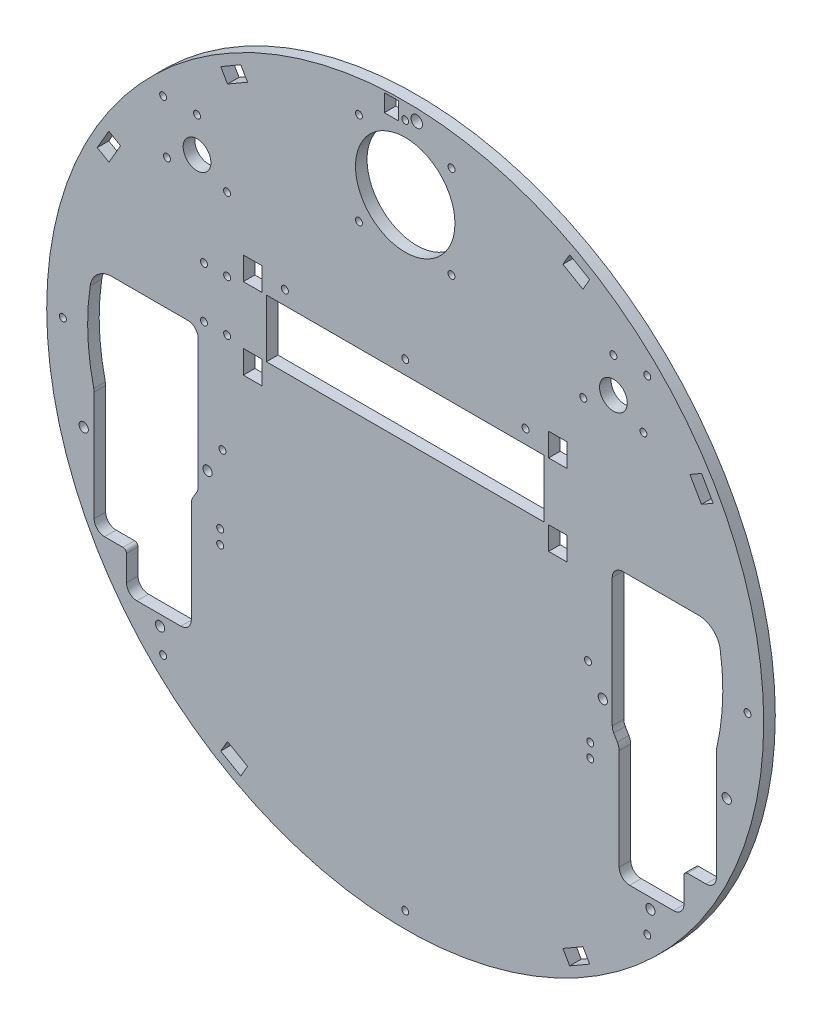
from build123d import *

# Parameters (mm, degrees)
SKETCH_1_R           = 155
EXTRUDE_1_DEPTH      = 5
SKETCH_3_R           = 6
CUT_EXTRUDE_3_DEPTH  = 10
SKETCH_7_R           = 21.5
CUT_EXTRUDE_7_DEPTH  = 10
SKETCH_8_R           = 1.5
CUT_EXTRUDE_8_DEPTH  = 7
SKETCH_12_R          = 1.5
CUT_EXTRUDE_12_DEPTH = 10
SKETCH_14_R          = 1.5
CUT_EXTRUDE_13_DEPTH = 220.260119493
SKETCH_15_R          = 1.5
SKETCH_15_W          = 120
SKETCH_15_H          = 25
CUT_EXTRUDE_14_DEPTH = 220.260119493
SKETCH_16_R          = 1.5
CUT_EXTRUDE_15_DEPTH = 220.260119493
SKETCH_17_R          = 3.25
CUT_EXTRUDE_16_DEPTH = 2
SKETCH_19_R          = 2
CUT_EXTRUDE_17_DEPTH = 220.260119493
SKETCH_20_R          = 1.5
CUT_EXTRUDE_18_DEPTH = 220.260119493
SKETCH_21_R          = 1.5
SKETCH_21_W          = 8
SKETCH_21_H          = 10
CUT_EXTRUDE_19_DEPTH = 220.260119493
SKETCH_23_R          = 2.5
SKETCH_23_W          = 6
SKETCH_23_H          = 7.5
CUT_EXTRUDE_20_DEPTH = 10


with BuildPart() as part:
    # 草图1 → 凸台-拉伸1 (new body)
    with BuildSketch(Plane.XY):
        Circle(SKETCH_1_R)
    extrude(amount=EXTRUDE_1_DEPTH)

    # 草图3 → 切除-拉伸3 (cut)
    with BuildSketch(Plane.XY.offset(5)):
        with Locations((90, 90)):
            Circle(SKETCH_3_R)
        with Locations((-90, 90)):
            Circle(SKETCH_3_R)
    extrude(amount=-CUT_EXTRUDE_3_DEPTH, mode=Mode.SUBTRACT)

    # 草图7 → 切除-拉伸7 (cut)
    with BuildSketch(Plane.XY.offset(5)):
        with Locations((0, 120)):
            Circle(SKETCH_7_R)
    extrude(amount=-CUT_EXTRUDE_7_DEPTH, mode=Mode.SUBTRACT)

    # 草图8 → 切除-拉伸8 (cut)
    with BuildSketch(Plane.XY.offset(5)):
        with Locations((-20, 140)):
            Circle(SKETCH_8_R)
        with Locations((-20, 100)):
            Circle(SKETCH_8_R)
        with Locations((20, 100)):
            Circle(SKETCH_8_R)
        with Locations((20, 140)):
            Circle(SKETCH_8_R)
    extrude(amount=-CUT_EXTRUDE_8_DEPTH, mode=Mode.SUBTRACT)

    # 草图12 → 切除-拉伸12 (cut)
    with BuildSketch(Plane.XY.offset(5)):
        with Locations((-90, 105)):
            Circle(SKETCH_12_R)
        with Locations((-77.009618943, 82.5)):
            Circle(SKETCH_12_R)
        with Locations((-102.990381057, 82.5)):
            Circle(SKETCH_12_R)
        with Locations((102.990381057, 82.5)):
            Circle(SKETCH_12_R)
        with Locations((77.009618943, 82.5)):
            Circle(SKETCH_12_R)
        with Locations((90, 105)):
            Circle(SKETCH_12_R)
    extrude(amount=-CUT_EXTRUDE_12_DEPTH, mode=Mode.SUBTRACT)

    # 草图14 → 切除-拉伸13 (cut, through all)
    with BuildSketch(Plane.XY.offset(5)):
        with Locations((-80, -45)):
            Circle(SKETCH_14_R)
        with Locations((-80, -51)):
            Circle(SKETCH_14_R)
        with Locations((80, -51)):
            Circle(SKETCH_14_R)
        with Locations((80, -45)):
            Circle(SKETCH_14_R)
    extrude(amount=-CUT_EXTRUDE_13_DEPTH, mode=Mode.SUBTRACT)

    # 草图15 → 切除-拉伸14 (cut, through all)
    with BuildSketch(Plane.XY.offset(5)):
        with Locations((-87, 51)):
            Circle(SKETCH_15_R)
        with Locations((-77, 51)):
            Circle(SKETCH_15_R)
        with Locations((-77, 29)):
            Circle(SKETCH_15_R)
        with Locations((-87, 29)):
            Circle(SKETCH_15_R)
        with Locations((0, 40)):
            Rectangle(SKETCH_15_W, SKETCH_15_H)
    extrude(amount=-CUT_EXTRUDE_14_DEPTH, mode=Mode.SUBTRACT)

    # 草图16 → 切除-拉伸15 (cut, through all)
    with BuildSketch(Plane.XY.offset(5)):
        with Locations((0, 148)):
            Circle(SKETCH_16_R)
        with Locations((104.651803616, 104.651803616)):
            Circle(SKETCH_16_R)
        with Locations((148, 0)):
            Circle(SKETCH_16_R)
        with Locations((104.651803616, -104.651803616)):
            Circle(SKETCH_16_R)
        with Locations((0, -148)):
            Circle(SKETCH_16_R)
        with Locations((-104.651803616, -104.651803616)):
            Circle(SKETCH_16_R)
        with Locations((-148, 0)):
            Circle(SKETCH_16_R)
        with Locations((-104.651803616, 104.651803616)):
            Circle(SKETCH_16_R)
    extrude(amount=-CUT_EXTRUDE_15_DEPTH, mode=Mode.SUBTRACT)

    # 草图17 → 切除-拉伸16 (cut)
    with BuildSketch(Plane(origin=(0, 0, 0), x_dir=(-1, 0, 0), z_dir=(0, 0, -1))):
        with Locations((-90, 105)):
            Circle(SKETCH_17_R)
        with Locations((-77.009618943, 82.5)):
            Circle(SKETCH_17_R)
        with Locations((-102.990381057, 82.5)):
            Circle(SKETCH_17_R)
        with Locations((102.990381057, 82.5)):
            Circle(SKETCH_17_R)
        with Locations((77.009618943, 82.5)):
            Circle(SKETCH_17_R)
        with Locations((90, 105)):
            Circle(SKETCH_17_R)
    extrude(amount=-CUT_EXTRUDE_16_DEPTH, mode=Mode.SUBTRACT)

    # 草图19 → 切除-拉伸17 (cut, through all)
    with BuildSketch(Plane(origin=(0, 0, 0), x_dir=(-1, 0, 0), z_dir=(0, 0, -1))):
        with Locations((-85.44, -26)):
            Circle(SKETCH_19_R)
        with Locations((-139, -36.5)):
            Circle(SKETCH_19_R)
        with Locations((-106, -94.5)):
            Circle(SKETCH_19_R)
        with Locations((106, -94.5)):
            Circle(SKETCH_19_R)
        with Locations((139, -36.5)):
            Circle(SKETCH_19_R)
        with Locations((85.44, -26)):
            Circle(SKETCH_19_R)
        with BuildLine():
            Line((92.5, -41.884919825), (92.5, -85.5))
            ThreePointArc((92.5, -85.5), (93.818019485, -88.681980515), (97, -90))
            Line((97, -90), (116, -90))
            ThreePointArc((116, -90), (119.181980515, -88.681980515), (120.5, -85.5))
            Line((120.5, -85.5), (120.5, -74.5))
            ThreePointArc((120.5, -74.5), (120.939339828, -73.439339828), (122, -73))
            Line((122, -73), (130, -73))
            ThreePointArc((130, -73), (133.181980515, -71.681980515), (134.5, -68.5))
            Line((134.5, -68.5), (134.5, -21.088475038))
            ThreePointArc((134.5, -21.088475038), (134.536795814, -20.45333724), (134.646690917, -19.826697774))
            ThreePointArc((134.646690917, -19.826697774), (137.219058182, -1.024043348), (136.174719632, 17.925))
            ThreePointArc((136.174719632, 17.925), (132.975444949, 23.703731672), (126.782202664, 26))
            Line((126.782202664, 26), (94, 26))
            ThreePointArc((94, 26), (90.818019485, 24.681980515), (89.5, 21.5))
            Line((89.5, 21.5), (89.5, -34.115080175))
            ThreePointArc((89.5, -34.115080175), (89.663282823, -35.316281294), (90.141281834, -36.430311075))
            Line((90.141281834, -36.430311075), (91.716211091, -39.05519317))
            ThreePointArc((91.716211091, -39.05519317), (92.300432105, -40.416785124), (92.5, -41.884919825))
        make_face()
        with BuildLine():
            Line((-91.716211091, -39.05519317), (-90.141281834, -36.430311075))
            ThreePointArc((-90.141281834, -36.430311075), (-89.663282823, -35.316281294), (-89.5, -34.115080175))
            Line((-89.5, -34.115080175), (-89.5, 21.5))
            ThreePointArc((-89.5, 21.5), (-90.818019485, 24.681980515), (-94, 26))
            Line((-94, 26), (-126.782202664, 26))
            ThreePointArc((-126.782202664, 26), (-132.975444949, 23.703731672), (-136.174719632, 17.925))
            ThreePointArc((-136.174719632, 17.925), (-137.219058182, -1.024043348), (-134.646690917, -19.826697774))
            ThreePointArc((-134.646690917, -19.826697774), (-134.536795814, -20.45333724), (-134.5, -21.088475038))
            Line((-134.5, -21.088475038), (-134.5, -68.5))
            ThreePointArc((-134.5, -68.5), (-133.181980515, -71.681980515), (-130, -73))
            Line((-130, -73), (-122, -73))
            ThreePointArc((-122, -73), (-120.939339828, -73.439339828), (-120.5, -74.5))
            Line((-120.5, -74.5), (-120.5, -85.5))
            ThreePointArc((-120.5, -85.5), (-119.181980515, -88.681980515), (-116, -90))
            Line((-116, -90), (-97, -90))
            ThreePointArc((-97, -90), (-93.818019485, -88.681980515), (-92.5, -85.5))
            Line((-92.5, -85.5), (-92.5, -41.884919825))
            ThreePointArc((-92.5, -41.884919825), (-92.300432105, -40.416785124), (-91.716211091, -39.05519317))
        make_face()
    extrude(amount=-CUT_EXTRUDE_17_DEPTH, mode=Mode.SUBTRACT)

    # 草图20 → 切除-拉伸18 (cut, through all)
    with BuildSketch(Plane(origin=(0, 0, 0), x_dir=(-1, 0, 0), z_dir=(0, 0, -1))):
        with Locations((-79, -15)):
            Circle(SKETCH_20_R)
        with Locations((79, -15)):
            Circle(SKETCH_20_R)
    extrude(amount=-CUT_EXTRUDE_18_DEPTH, mode=Mode.SUBTRACT)

    # 草图21 → 切除-拉伸19 (cut, through all)
    with BuildSketch(Plane(origin=(0, 0, 0), x_dir=(-1, 0, 0), z_dir=(0, 0, -1))):
        with Locations((-52, 58.5)):
            Circle(SKETCH_21_R)
        with Locations((0, 58.5)):
            Circle(SKETCH_21_R)
        with Locations((52, 58.5)):
            Circle(SKETCH_21_R)
        with Locations((-66, 57.5)):
            Rectangle(SKETCH_21_W, SKETCH_21_H)
        with Locations((-66, 22.5)):
            Rectangle(SKETCH_21_W, SKETCH_21_H)
        with Locations((66, 22.5)):
            Rectangle(SKETCH_21_W, SKETCH_21_H)
        with Locations((66, 57.5)):
            Rectangle(SKETCH_21_W, SKETCH_21_H)
    extrude(amount=-CUT_EXTRUDE_19_DEPTH, mode=Mode.SUBTRACT)

    # 草图23 → 切除-拉伸20 (cut)
    with BuildSketch(Plane.XY.offset(5)):
        with Locations((5, 150)):
            Circle(SKETCH_23_R)
        Polygon((71.094872981, 133.139932161), (68.169872981, 128.073683549), (76.830127019, 123.073683549), (79.755127019, 128.139932161), align=None)
        Polygon((128.139932161, 79.755127019), (123.073683549, 76.830127019), (128.073683549, 68.169872981), (133.139932161, 71.094872981), align=None)
        with Locations((-6, 150)):
            Rectangle(SKETCH_23_W, SKETCH_23_H)
        Polygon((79.755127019, -128.139932161), (76.830127019, -123.073683549), (68.169872981, -128.073683549), (71.094872981, -133.139932161), align=None)
        Polygon((-71.094872981, -133.139932161), (-68.169872981, -128.073683549), (-76.830127019, -123.073683549), (-79.755127019, -128.139932161), align=None)
        Polygon((-133.139932161, 71.094872981), (-128.073683549, 68.169872981), (-123.073683549, 76.830127019), (-128.139932161, 79.755127019), align=None)
        Polygon((-79.755127019, 128.139932161), (-76.830127019, 123.073683549), (-68.169872981, 128.073683549), (-71.094872981, 133.139932161), align=None)
    extrude(amount=-CUT_EXTRUDE_20_DEPTH, mode=Mode.SUBTRACT)


solid = part.part
